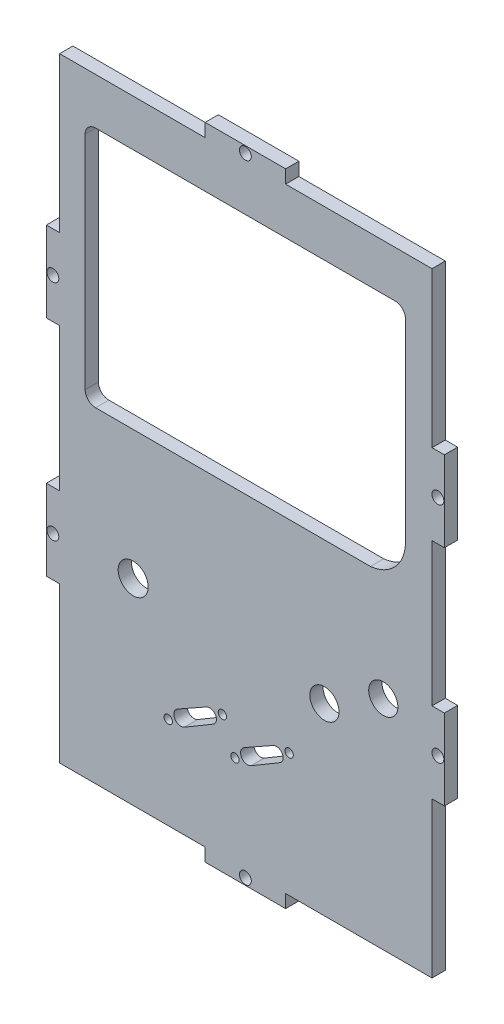
from build123d import *

# Parameters (mm, degrees)
SKETCH1_7_W             = 89.29
SKETCH1_7_H             = 147.294272307
SKETCH1_7_R             = 1
SKETCH1_7_R_2           = 3.6
SKETCH1_7_R_3           = 3.5
BODY_DEPTH              = 3.18
SKETCH2_W               = 19.3
SKETCH2_H               = 3.18
BOSS_EXTRUDE1_DEPTH     = 3.18
SKETCH3_R               = 1.425
CUT_EXTRUDE1_DEPTH      = 89.95245291
SKETCH4_W               = 3.18
SKETCH4_H               = 19.3
BOSS_EXTRUDE2_DEPTH     = 3.18
SKETCH5_R               = 1.425
CUT_EXTRUDE2_DEPTH      = 91.482140695
MIRROR2_COPY_1_SKETCH_W = 3.18
MIRROR2_COPY_1_SKETCH_H = 19.3
MIRROR2_COPY_1_DEPTH    = 3.18
MIRROR2_COPY_2_SKETCH_R = 1.425
MIRROR2_COPY_2_DEPTH    = 91.482140695
MIRROR2_COPY_3_SKETCH_W = 3.18
MIRROR2_COPY_3_SKETCH_H = 19.3
MIRROR2_COPY_3_DEPTH    = 3.18
MIRROR2_COPY_4_SKETCH_R = 1.425
MIRROR2_COPY_4_DEPTH    = 91.482140695


with BuildPart() as part:
    # Sketch1<7> → Body (new body)
    with BuildSketch(Plane.XY):
        with Locations((0.105848892, -0.017058674)):
            Rectangle(SKETCH1_7_W, SKETCH1_7_H)
        with Locations((-18.500240022, -51.564194828)):
            Circle(SKETCH1_7_R, mode=Mode.SUBTRACT)
        with BuildLine():
            Line((-7.741744524, -47.198455643), (-12.157690739, -49.814194828))
            Line((-12.157690739, -49.814194828), (-14.641551271, -51.285483428))
            ThreePointArc((-14.641551271, -51.285483428), (-16.940439708, -50.641794665), (-16.296750946, -48.342906228))
            Line((-16.296750946, -48.342906228), (-9.324146649, -44.420816311))
            ThreePointArc((-9.324146649, -44.420816311), (-7.152105158, -45.022980632), (-7.741744524, -47.198455643))
        make_face(mode=Mode.SUBTRACT)
        with Locations((-2.500240022, -51.564194828)):
            Circle(SKETCH1_7_R, mode=Mode.SUBTRACT)
        with Locations((-5.509858965, -44.064194828)):
            Circle(SKETCH1_7_R, mode=Mode.SUBTRACT)
        with Locations((-26.900831216, -26.517202566)):
            Circle(SKETCH1_7_R_2, mode=Mode.SUBTRACT)
        with BuildLine():
            ThreePointArc((1.358448729, -51.285483428), (-0.321371004, -51.271360873), (-1.157230382, -49.814194828))
            ThreePointArc((-1.157230382, -49.814194828), (-0.926317154, -48.961974932), (-0.296750946, -48.342906228))
            Line((-0.296750946, -48.342906228), (6.675853351, -44.420816311))
            ThreePointArc((6.675853351, -44.420816311), (8.847894842, -45.022980632), (8.258255476, -47.198455643))
            Line((8.258255476, -47.198455643), (1.358448729, -51.285483428))
        make_face(mode=Mode.SUBTRACT)
        with Locations((10.490141035, -44.064194828)):
            Circle(SKETCH1_7_R, mode=Mode.SUBTRACT)
        with Locations((18.957561099, -29.561304194)):
            Circle(SKETCH1_7_R_3, mode=Mode.SUBTRACT)
        with Locations((33.068305831, -21.491722051)):
            Circle(SKETCH1_7_R_3, mode=Mode.SUBTRACT)
        with BuildLine():
            Line((-35.919151108, 62.490077479), (35.889642662, 62.490077479))
            ThreePointArc((35.889642662, 62.490077479), (37.657409615, 61.757844432), (38.389642662, 59.990077479))
            Line((38.389642662, 59.990077479), (38.389642662, 13.668014642))
            ThreePointArc((38.389642662, 13.668014642), (35.990372343, 7.41277043), (29.997375098, 4.418014642))
            Line((29.997375098, 4.418014642), (-35.919151108, 4.418014642))
            ThreePointArc((-35.919151108, 4.418014642), (-37.686918061, 5.150247689), (-38.419151108, 6.918014642))
            Line((-38.419151108, 6.918014642), (-38.419151108, 59.990077479))
            ThreePointArc((-38.419151108, 59.990077479), (-37.686918061, 61.757844432), (-35.919151108, 62.490077479))
        make_face(mode=Mode.SUBTRACT)
    extrude(amount=BODY_DEPTH)

    # Sketch2 → Boss-Extrude1 (add)
    with BuildSketch(Plane(origin=(0, 73.630077479, 0), x_dir=(1, 0, 0), z_dir=(0, 1, 0))):
        with Locations((0, -1.59)):
            Rectangle(SKETCH2_W, SKETCH2_H)
    boss_extrude1 = extrude(amount=BOSS_EXTRUDE1_DEPTH)

    # Sketch3 → Cut-Extrude1 (cut, through all)
    with BuildSketch(Plane.XY.offset(3.18)):
        with Locations((0, 75.220077479)):
            Circle(SKETCH3_R)
    cut_extrude1 = extrude(amount=-CUT_EXTRUDE1_DEPTH, mode=Mode.SUBTRACT)

    # Sketch4 → Boss-Extrude2 (add)
    with BuildSketch(Plane.ZY.offset(44.539151108)):
        with Locations((1.59, 26.810077479)):
            Rectangle(SKETCH4_W, SKETCH4_H)
    boss_extrude2 = extrude(amount=BOSS_EXTRUDE2_DEPTH)

    # Sketch5 → Cut-Extrude2 (cut, through all)
    with BuildSketch(Plane.XY.offset(3.18)):
        with Locations((-46.161220751, 26.810077479)):
            Circle(SKETCH5_R)
    cut_extrude2 = extrude(amount=-CUT_EXTRUDE2_DEPTH, mode=Mode.SUBTRACT)

    # Mirror1: Boss-Extrude2, Cut-Extrude2 across plane
    add(boss_extrude2.mirror(Plane(origin=(0, 0, 0), x_dir=(0, 0, 1), z_dir=(1, 0, 0))))
    add(cut_extrude2.mirror(Plane(origin=(0, 0, 0), x_dir=(0, 0, 1), z_dir=(1, 0, 0))), mode=Mode.SUBTRACT)

    # Mirror2: Boss-Extrude1, Cut-Extrude1 across plane
    add(boss_extrude1.mirror(Plane.ZX))
    add(cut_extrude1.mirror(Plane.ZX), mode=Mode.SUBTRACT)

    # Mirror2 copy 1 sketch → Mirror2 copy 1 (add)
    with BuildSketch(Plane(origin=(44.539151108, 0, 0), x_dir=(0, 0, 1), z_dir=(1, 0, 0))):
        with Locations((1.59, 26.810077479)):
            Rectangle(MIRROR2_COPY_1_SKETCH_W, MIRROR2_COPY_1_SKETCH_H)
    extrude(amount=MIRROR2_COPY_1_DEPTH)

    # Mirror2 copy 2 sketch → Mirror2 copy 2 (cut, through all)
    with BuildSketch(Plane(origin=(0, 0, 3.18), x_dir=(-1, 0, 0), z_dir=(0, 0, 1))):
        with Locations((-46.161220751, 26.810077479)):
            Circle(MIRROR2_COPY_2_SKETCH_R)
    extrude(amount=-MIRROR2_COPY_2_DEPTH, mode=Mode.SUBTRACT)

    # Mirror2 copy 3 sketch → Mirror2 copy 3 (add)
    with BuildSketch(Plane.ZY.offset(44.539151108)):
        with Locations((1.59, -26.810077479)):
            Rectangle(MIRROR2_COPY_3_SKETCH_W, MIRROR2_COPY_3_SKETCH_H)
    extrude(amount=MIRROR2_COPY_3_DEPTH)

    # Mirror2 copy 4 sketch → Mirror2 copy 4 (cut, through all)
    with BuildSketch(Plane.XY.offset(3.18)):
        with Locations((-46.161220751, -26.810077479)):
            Circle(MIRROR2_COPY_4_SKETCH_R)
    extrude(amount=-MIRROR2_COPY_4_DEPTH, mode=Mode.SUBTRACT)


solid = part.part
